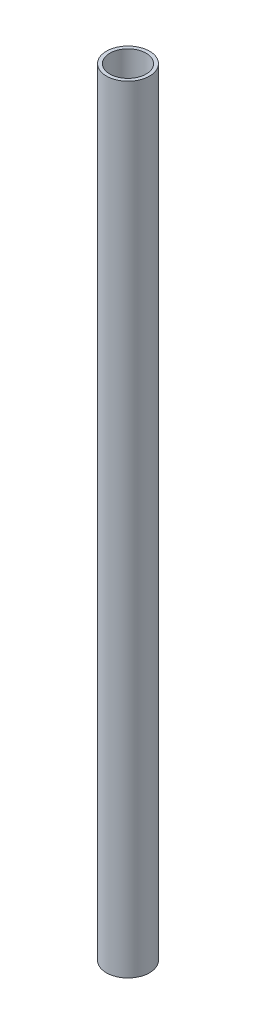
from build123d import *

# Parameters (mm, degrees)
CROQUIS1_R              = 12.5
CROQUIS1_R_2            = 10.5
SALIENTE_EXTRUIR1_DEPTH = 450


with BuildPart() as part:
    # Croquis1 → Saliente-Extruir1 (new body)
    with BuildSketch(Plane(origin=(0, 0, 0), x_dir=(1, 0, 0), z_dir=(0, 1, 0))):
        with Locations(Location((0, 0, 0), (0, 0, 270))):
            Circle(CROQUIS1_R)
        with Locations(Location((0, 0, 0), (0, 0, 270))):
            Circle(CROQUIS1_R_2, mode=Mode.SUBTRACT)
    extrude(amount=SALIENTE_EXTRUIR1_DEPTH)


solid = part.part
